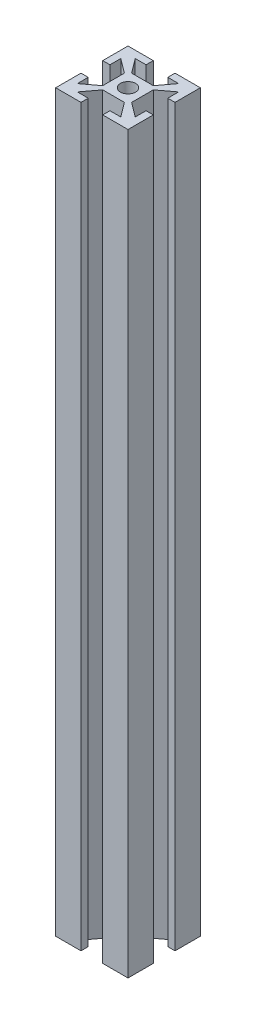
from build123d import *

# Parameters (mm, degrees)
SKETCH1_W           = 20
SKETCH1_H           = 20
BOSS_EXTRUDE1_DEPTH = 101.6
CUT_EXTRUDE1_DEPTH  = 203.2
SKETCH3_R           = 2.1
CUT_EXTRUDE2_DEPTH  = 13
CUT_EXTRUDE3_START  = -13
SKETCH4_R           = 2.1
CUT_EXTRUDE3_DEPTH  = 13


with BuildPart() as part:
    # Sketch1 → Boss-Extrude1 (new, symmetric)
    with BuildSketch(Plane(origin=(0, 0, 0), x_dir=(1, 0, 0), z_dir=(0, 1, 0))):
        Rectangle(SKETCH1_W, SKETCH1_H)
    extrude(amount=BOSS_EXTRUDE1_DEPTH, both=True)

    # Sketch2 → Cut-Extrude1 (cut)
    with BuildSketch(Plane(origin=(0, 101.6, 0), x_dir=(1, 0, 0), z_dir=(0, 1, 0))):
        Polygon((-10, -3), (-10, 3), (-8, 3), (-8, 6), (-4.000000001, 3), (-4.000000001, -3), (-8, -6), (-8, -3), align=None)
        Polygon((3, 4.000000001), (6, 8), (3, 8), (3, 10), (-3, 10), (-3, 8), (-6, 8), (-3, 4.000000001), align=None)
        Polygon((4.000000001, -3), (8, -6), (8, -3), (10, -3), (10, 3), (8, 3), (8, 6), (4.000000001, 3), align=None)
        Polygon((-3, -4.000000001), (-6, -8), (-3, -8), (-3, -10), (3, -10), (3, -8), (6, -8), (3, -4.000000001), align=None)
    extrude(amount=-CUT_EXTRUDE1_DEPTH, mode=Mode.SUBTRACT)

    # Sketch3 → Cut-Extrude2 (cut)
    with BuildSketch(Plane(origin=(0, 101.6, 0), x_dir=(1, 0, 0), z_dir=(0, 1, 0))):
        with Locations(Location((0, 0, 0), (0, 0, 270))):
            Circle(SKETCH3_R)
    extrude(amount=-CUT_EXTRUDE2_DEPTH, mode=Mode.SUBTRACT)

    # Sketch4 → Cut-Extrude3 (cut)
    with BuildSketch(Plane.XZ.offset(101.6).offset(CUT_EXTRUDE3_START)):
        with Locations(Location((0, 0, 0), (0, 0, 90))):
            Circle(SKETCH4_R)
    extrude(amount=CUT_EXTRUDE3_DEPTH, mode=Mode.SUBTRACT)


solid = part.part
